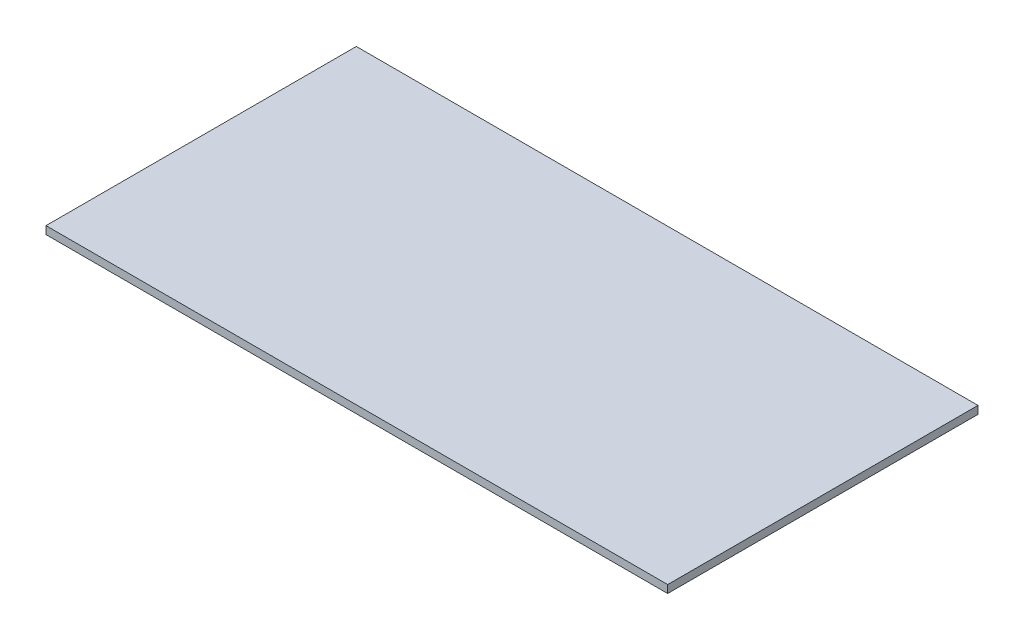
from build123d import *

# Parameters (mm, degrees)
SKETCH1_W           = 2396
SKETCH1_H           = 1196
BOSS_EXTRUDE1_DEPTH = 30


with BuildPart() as part:
    # Sketch1 → Boss-Extrude1 (new body)
    with BuildSketch(Plane(origin=(0, 0, 0), x_dir=(1, 0, 0), z_dir=(0, 1, 0))):
        Rectangle(SKETCH1_W, SKETCH1_H)
    extrude(amount=BOSS_EXTRUDE1_DEPTH)


solid = part.part
